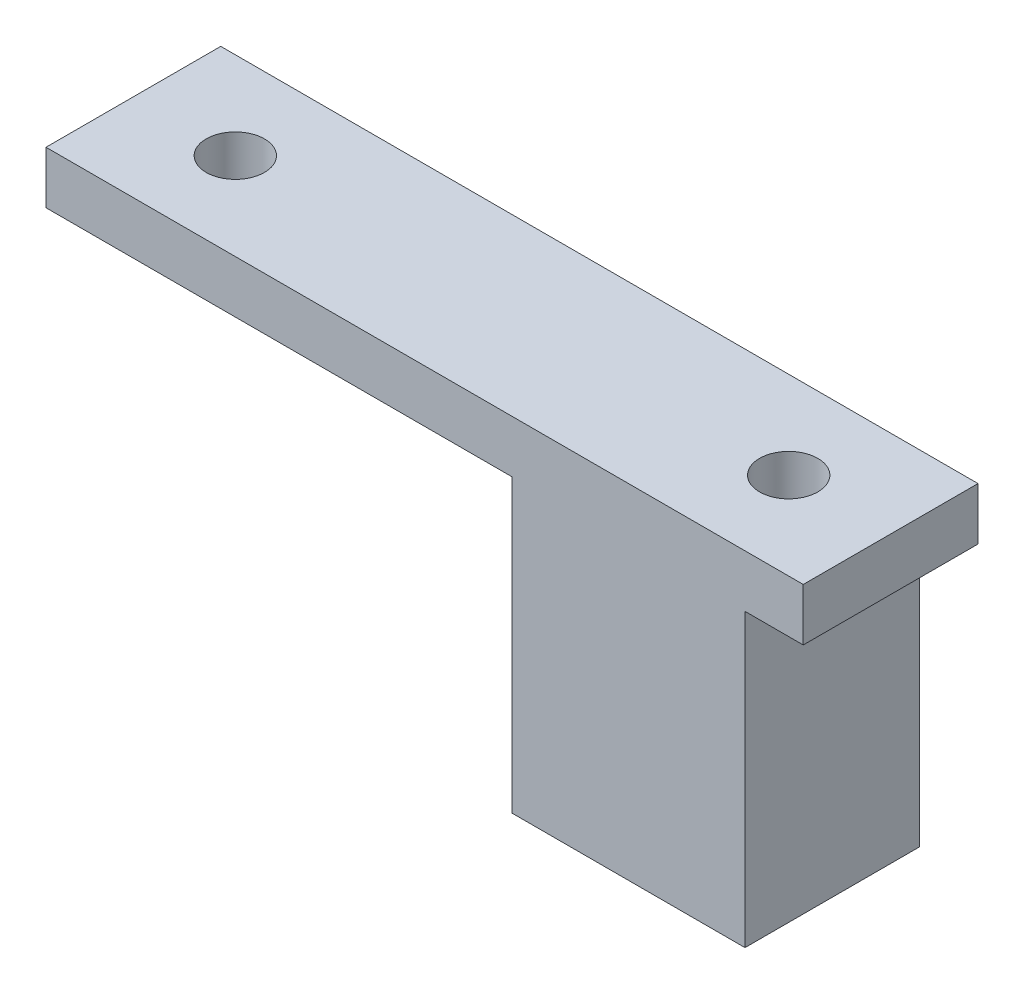
from build123d import *

# Parameters (mm, degrees)
SKETCH1_W           = 8
SKETCH1_H           = 6
BOSS_EXTRUDE1_DEPTH = 10
SKETCH3_W           = 26
SKETCH3_H           = 6
SKETCH3_R           = 1
BOSS_EXTRUDE2_DEPTH = 1.8
SKETCH4_W           = 5.9
SKETCH4_H           = 3.2
CUT_EXTRUDE1_DEPTH  = 7
CUT_EXTRUDE2_START  = -4
SKETCH6_R           = 1
CUT_EXTRUDE2_DEPTH  = 4


with BuildPart() as part:
    # Sketch1 → Boss-Extrude1 (new body)
    with BuildSketch(Plane(origin=(0, 0, 0), x_dir=(1, 0, 0), z_dir=(0, 1, 0))):
        with Locations((-4, 3)):
            Rectangle(SKETCH1_W, SKETCH1_H)
    extrude(amount=BOSS_EXTRUDE1_DEPTH)

    # Sketch3 → Boss-Extrude2 (add)
    with BuildSketch(Plane(origin=(0, 10, 0), x_dir=(1, 0, 0), z_dir=(0, 1, 0))):
        with Locations((-11, 3)):
            Rectangle(SKETCH3_W, SKETCH3_H)
        with Locations(Location((-20.5, 3, 0), (0, 0, 270))):
            Circle(SKETCH3_R, mode=Mode.SUBTRACT)
        with Locations(Location((-1.5, 3, 0), (0, 0, 90))):
            Circle(SKETCH3_R, mode=Mode.SUBTRACT)
    extrude(amount=BOSS_EXTRUDE2_DEPTH)

    # Sketch4 → Cut-Extrude1 (cut)
    with BuildSketch(Plane.XZ):
        with Locations((-4, -3)):
            Rectangle(SKETCH4_W, SKETCH4_H)
    extrude(amount=-CUT_EXTRUDE1_DEPTH, mode=Mode.SUBTRACT)

    # Sketch6 → Cut-Extrude2 (cut)
    with BuildSketch(Plane(origin=(0, 11.8, 0), x_dir=(1, 0, 0), z_dir=(0, 1, 0)).offset(CUT_EXTRUDE2_START)):
        with Locations(Location((-1.5, 3, 0), (0, 0, 90))):
            Circle(SKETCH6_R)
    extrude(amount=CUT_EXTRUDE2_DEPTH, mode=Mode.SUBTRACT)


solid = part.part
